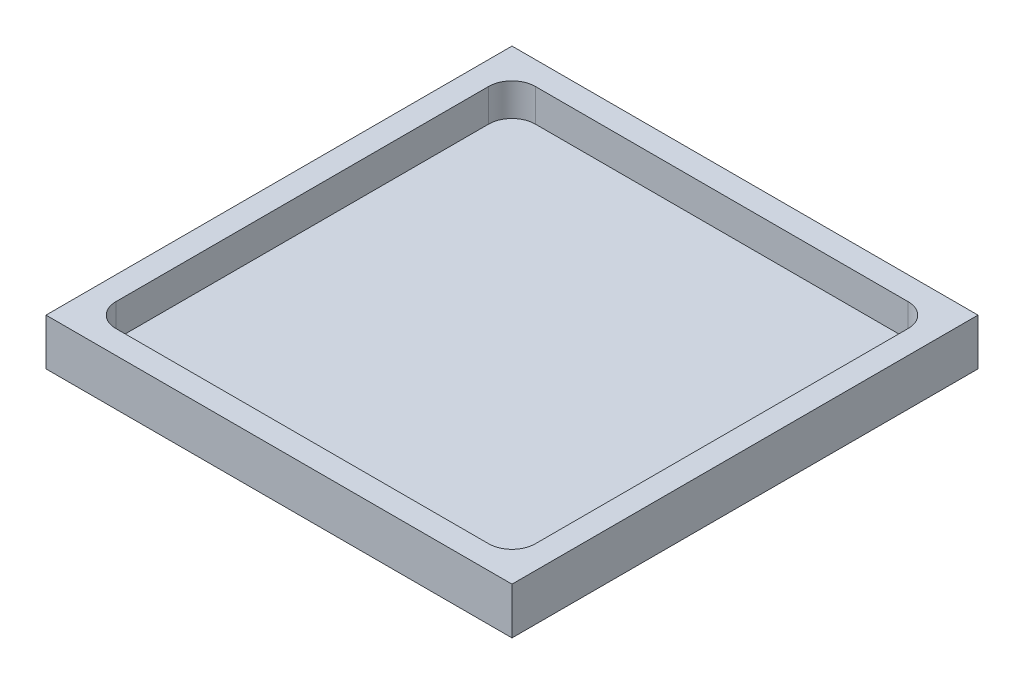
from build123d import *

# Parameters (mm, degrees)
SKETCH2_W           = 100
SKETCH2_H           = 100
BOSS_EXTRUDE1_DEPTH = 10
SKETCH3_W           = 90
SKETCH3_H           = 90
CUT_EXTRUDE1_DEPTH  = 7
FILLET2_R           = 5


with BuildPart() as part:
    # Sketch2 → Boss-Extrude1 (new body)
    with BuildSketch(Plane(origin=(0, 0, 0), x_dir=(1, 0, 0), z_dir=(0, 1, 0))):
        with Locations((50, 50)):
            Rectangle(SKETCH2_W, SKETCH2_H)
    extrude(amount=BOSS_EXTRUDE1_DEPTH)

    # Sketch3 → Cut-Extrude1 (cut)
    with BuildSketch(Plane(origin=(0, 10, 0), x_dir=(1, 0, 0), z_dir=(0, 1, 0))):
        with Locations((50, 50)):
            Rectangle(SKETCH3_W, SKETCH3_H)
    extrude(amount=-CUT_EXTRUDE1_DEPTH, mode=Mode.SUBTRACT)

    # Fillet2
    fillet2_edges = [part.edges().sort_by_distance(p)[0] for p in [
        (5, 6.5, -5),
        (5, 6.5, -95),
        (95, 6.5, -95),
        (95, 6.5, -5),
    ]]
    fillet(fillet2_edges, radius=FILLET2_R)


solid = part.part
